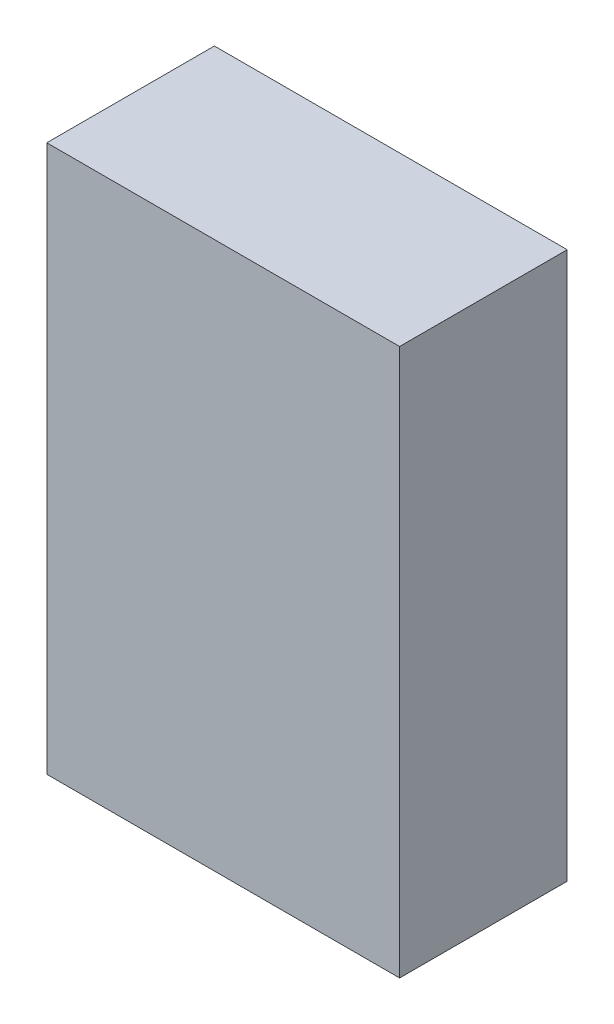
from build123d import *

# Parameters (mm, degrees)
SKETCH1_W           = 20
SKETCH1_H           = 31
BOSS_EXTRUDE1_DEPTH = 9.5


with BuildPart() as part:
    # Sketch1 → Boss-Extrude1 (new body)
    with BuildSketch(Plane.XY):
        Rectangle(SKETCH1_W, SKETCH1_H)
    extrude(amount=BOSS_EXTRUDE1_DEPTH)


solid = part.part
